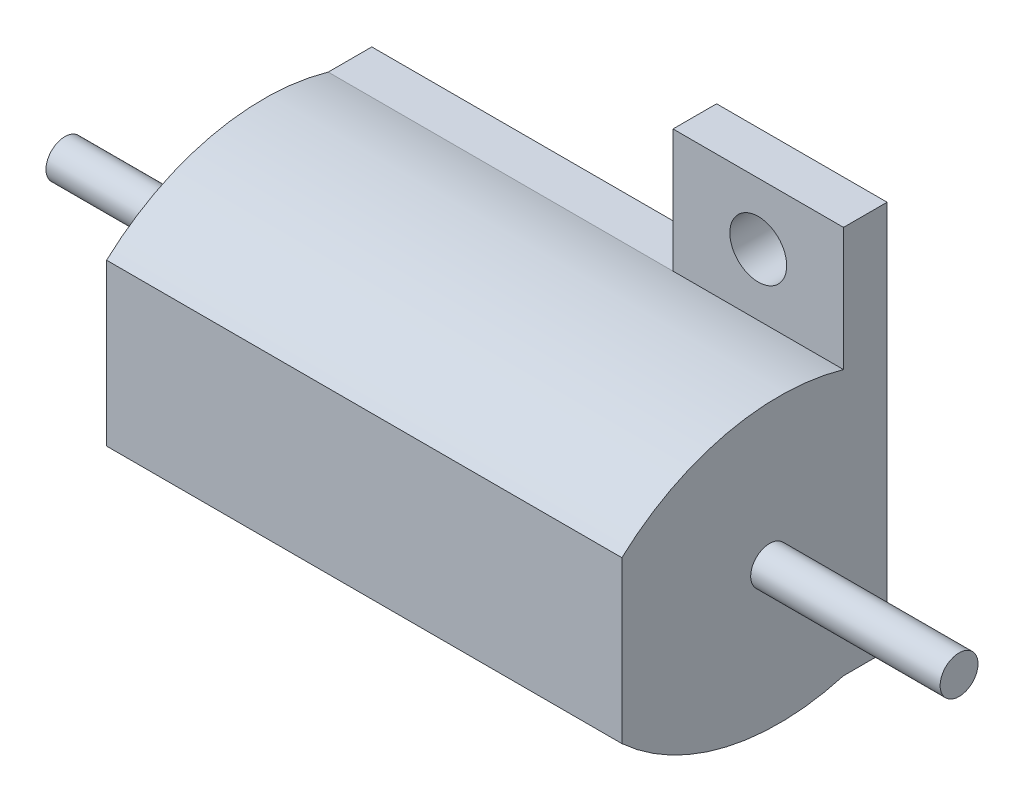
from build123d import *

# Parameters (mm, degrees)
SKETCH_1_W           = 27.2
SKETCH_1_H           = 14
EXTRUDE_1_DEPTH      = 2.3
SKETCH_2_W           = 9
SKETCH_2_H           = 6.5
SKETCH_2_R           = 1.5
EXTRUDE_2_DEPTH      = 2.3
EXTRUDE_3_REACH      = 32.453
EXTRUDE_4_DEPTH      = 23.6
EXTRUDE_4_DEPTH_BACK = 23.6
SKETCH_5_R           = 1


with BuildPart() as part:
    # 草图1 → 拉伸1 (new body)
    with BuildSketch(Plane.XY):
        Rectangle(SKETCH_1_W, SKETCH_1_H)
    extrude(amount=EXTRUDE_1_DEPTH)

    # 草图2 → 拉伸2 (add)
    # profile 1 of 2: a face of its own
    with BuildSketch(Plane(origin=(0, 0, 0), x_dir=(-1, 0, 0), z_dir=(0, 0, -1))):
        with Locations((9.1, -10.25)):
            Rectangle(SKETCH_2_W, SKETCH_2_H)
        with Locations((9.1, -10.25)):
            Circle(SKETCH_2_R, mode=Mode.SUBTRACT)
    # profile 2 of 2: a face of its own
    with BuildSketch(Plane(origin=(0, 0, 0), x_dir=(-1, 0, 0), z_dir=(0, 0, -1))):
        with Locations((-9.1, 10.25)):
            Rectangle(SKETCH_2_W, SKETCH_2_H)
        with Locations((-9.1, 10.25)):
            Circle(SKETCH_2_R, mode=Mode.SUBTRACT)
    extrude(amount=-EXTRUDE_2_DEPTH)

    # 拉伸3: up to this face of the body (flat: up to its plane)
    extrude_3_end = Plane(part.part.faces().sort_by_distance((-13.6, -3.25, 1.15))[0])
    # 草图4 → 拉伸3 (add, up to the picked face)
    with BuildSketch(Plane(origin=(13.6, 0, 0), x_dir=(0, 0, -1), z_dir=(1, 0, 0)), mode=Mode.PRIVATE) as extrude_3_sk1:
        with BuildLine():
            Line((-2.3, -7), (-2.3, 7))
            ThreePointArc((-2.3, 7), (-8.509289243, 7.153612414), (-14, 4.25))
            Line((-14, 4.25), (-14, -4.25))
            ThreePointArc((-14, -4.25), (-8.509289243, -7.153612414), (-2.3, -7))
        make_face()
    extrude_3_tool1 = split(extrude(extrude_3_sk1.sketch, amount=-EXTRUDE_3_REACH, mode=Mode.PRIVATE), bisect_by=extrude_3_end, keep=Keep.BOTH, mode=Mode.PRIVATE)
    add(extrude_3_tool1.solids().sort_by(Axis((13.6, 0, 7.774162), (-1, 0, 0)))[0])

    # 草图5 → 拉伸4 (add, two sides: drawn at the far end of the back side and taken through both)
    with BuildSketch(Plane(origin=(0, 0, 0), x_dir=(0, 0, -1), z_dir=(1, 0, 0)).offset(-EXTRUDE_4_DEPTH_BACK)):
        with Locations(Location((-6.2, 0, 0), (0, 0, 270))):
            Circle(SKETCH_5_R)
    extrude(amount=EXTRUDE_4_DEPTH + EXTRUDE_4_DEPTH_BACK)


solid = part.part
